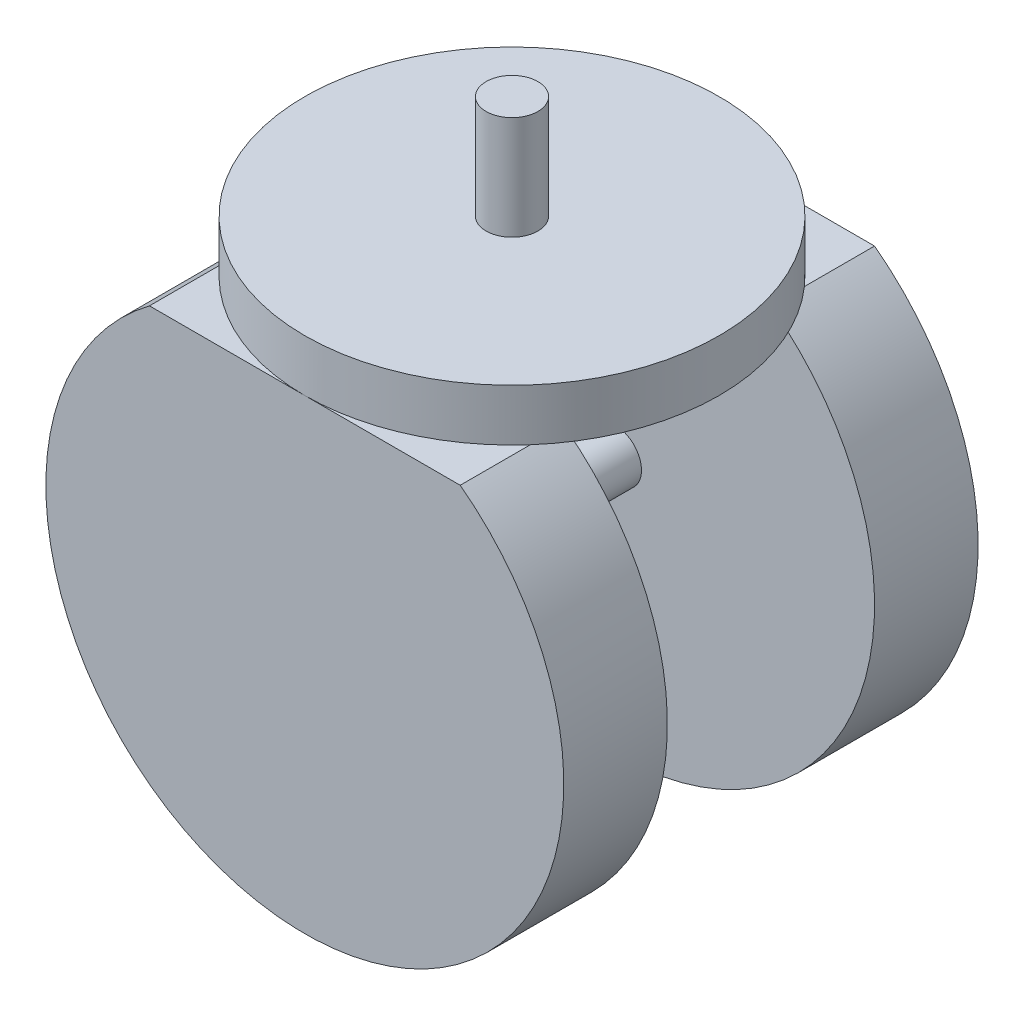
from build123d import *

# Parameters (mm, degrees)
SKETCH1_R           = 63.5
BOSS_EXTRUDE2_DEPTH = 25.4
SKETCH2_R           = 6.35
BOSS_EXTRUDE3_DEPTH = 50.8
BOSS_EXTRUDE4_START = 25.4
SKETCH3_R           = 63.5
BOSS_EXTRUDE4_DEPTH = 25.4
CUT_EXTRUDE2_START  = 50.8
SKETCH4_W           = 127
SKETCH4_H           = 101.6
CUT_EXTRUDE2_DEPTH  = 76.2
SKETCH5_R           = 50.8
BOSS_EXTRUDE5_DEPTH = 12.7
SKETCH6_R           = 6.35
BOSS_EXTRUDE6_DEPTH = 25.4


with BuildPart() as part:
    # Sketch1 → Boss-Extrude2 (new body)
    with BuildSketch(Plane.XY):
        Circle(SKETCH1_R)
    extrude(amount=BOSS_EXTRUDE2_DEPTH)

    # Sketch2 → Boss-Extrude3 (add)
    with BuildSketch(Plane(origin=(0, 0, 0), x_dir=(-1, 0, 0), z_dir=(0, 0, -1))):
        with Locations(Location((0, 0, 0), (0, 0, 180))):
            Circle(SKETCH2_R)
    extrude(amount=BOSS_EXTRUDE3_DEPTH)

    # Sketch3 → Boss-Extrude4 (add)
    with BuildSketch(Plane(origin=(0, 0, -50.8), x_dir=(-1, 0, 0), z_dir=(0, 0, -1)).offset(BOSS_EXTRUDE4_START)):
        with Locations(Location((0, 0, 0), (0, 0, 180))):
            Circle(SKETCH3_R)
    extrude(amount=-BOSS_EXTRUDE4_DEPTH)

    # Sketch4 → Cut-Extrude2 (cut)
    with BuildSketch(Plane(origin=(0, 0, 0), x_dir=(1, 0, 0), z_dir=(0, 1, 0)).offset(CUT_EXTRUDE2_START)):
        with Locations((0, 25.4)):
            Rectangle(SKETCH4_W, SKETCH4_H)
    extrude(amount=CUT_EXTRUDE2_DEPTH, mode=Mode.SUBTRACT)

    # Sketch5 → Boss-Extrude5 (add)
    with BuildSketch(Plane(origin=(0, 50.8, 0), x_dir=(1, 0, 0), z_dir=(0, 1, 0))):
        with Locations(Location((0, 25.4, 0), (0, 0, 270))):
            Circle(SKETCH5_R)
    extrude(amount=BOSS_EXTRUDE5_DEPTH)

    # Sketch6 → Boss-Extrude6 (add)
    with BuildSketch(Plane(origin=(0, 63.5, 0), x_dir=(1, 0, 0), z_dir=(0, 1, 0))):
        with Locations(Location((0, 25.4, 0), (0, 0, 270))):
            Circle(SKETCH6_R)
    extrude(amount=BOSS_EXTRUDE6_DEPTH)


solid = part.part
